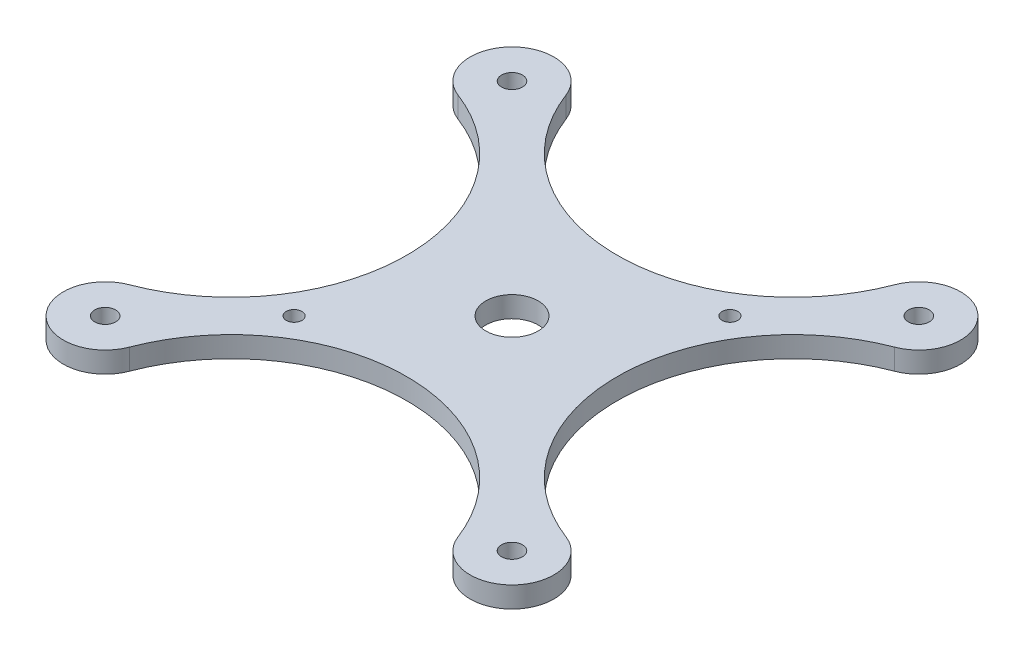
from build123d import *

# Parameters (mm, degrees)
SKETCH1_R           = 2
SKETCH1_R_2         = 5
SKETCH1_R_3         = 1.5
BOSS_EXTRUDE1_DEPTH = 4


with BuildPart() as part:
    # Sketch1 → Boss-Extrude1 (new body)
    with BuildSketch(Plane(origin=(0, 0, 0), x_dir=(1, 0, 0), z_dir=(0, 1, 0))):
        with BuildLine():
            ThreePointArc((-31.416051551, 41.741670191), (0, 20.1), (31.416051551, 41.741670191))
            ThreePointArc((31.416051551, 41.741670191), (44.547727215, 44.547727215), (41.741670191, 31.416051551))
            ThreePointArc((41.741670191, 31.416051551), (20.1, 0), (41.741670191, -31.416051551))
            ThreePointArc((41.741670191, -31.416051551), (44.547727215, -44.547727215), (31.416051551, -41.741670191))
            ThreePointArc((31.416051551, -41.741670191), (0, -20.1), (-31.416051551, -41.741670191))
            ThreePointArc((-31.416051551, -41.741670191), (-44.547727215, -44.547727215), (-41.741670191, -31.416051551))
            ThreePointArc((-41.741670191, -31.416051551), (-20.1, 0), (-41.741670191, 31.416051551))
            ThreePointArc((-41.741670191, 31.416051551), (-44.547727215, 44.547727215), (-31.416051551, 41.741670191))
        make_face()
        with Locations(Location((-38.890872965, 38.890872965, 0), (0, 0, 270))):
            Circle(SKETCH1_R, mode=Mode.SUBTRACT)
        with Locations(Location((38.890872965, 38.890872965, 0), (0, 0, 270))):
            Circle(SKETCH1_R, mode=Mode.SUBTRACT)
        with Locations(Location((38.890872965, -38.890872965, 0), (0, 0, 270))):
            Circle(SKETCH1_R, mode=Mode.SUBTRACT)
        with Locations(Location((-38.890872965, -38.890872965, 0), (0, 0, 270))):
            Circle(SKETCH1_R, mode=Mode.SUBTRACT)
        with Locations(Location((0, 0, 0), (0, 0, 270))):
            Circle(SKETCH1_R_2, mode=Mode.SUBTRACT)
        with Locations(Location((20.831365774, 20.831365774, 0), (0, 0, 270))):
            Circle(SKETCH1_R_3, mode=Mode.SUBTRACT)
        with Locations(Location((-20.831365774, -20.831365774, 0), (0, 0, 270))):
            Circle(SKETCH1_R_3, mode=Mode.SUBTRACT)
    extrude(amount=BOSS_EXTRUDE1_DEPTH)


solid = part.part
